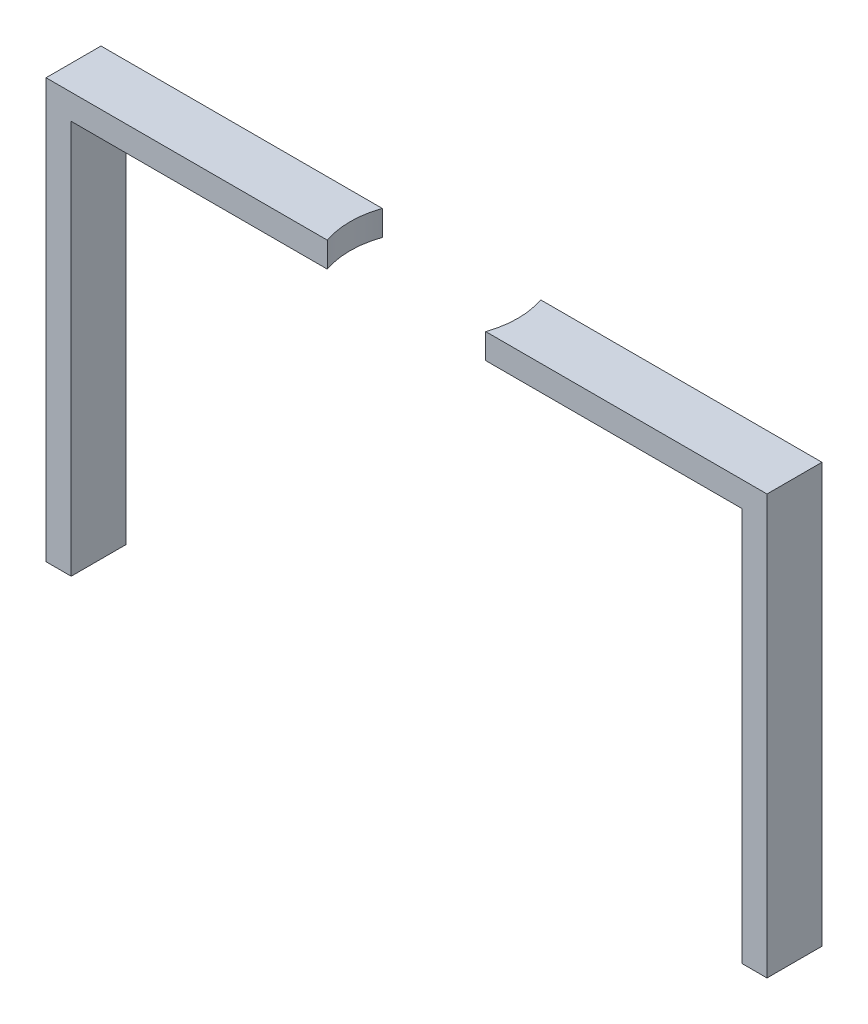
from build123d import *

# Parameters (mm, degrees)
EXTRUDE_1_DEPTH     = 32.78
SKETCH_2_R          = 50
CUT_EXTRUDE_1_DEPTH = 15


with BuildPart() as part:
    # 草图1 → 凸台-拉伸1 (new body)
    with BuildSketch(Plane.XY):
        Polygon((-369.854368932, -113.927184466), (-354.854368932, -113.927184466), (-354.854368932, 121.072815534), (45.145631068, 121.072815534), (45.145631068, -113.927184466), (60.145631068, -113.927184466), (60.145631068, 136.072815534), (-369.854368932, 136.072815534), align=None)
    extrude(amount=EXTRUDE_1_DEPTH)

    # 草图2 → 切除-拉伸1 (cut)
    with BuildSketch(Plane(origin=(0, 136.072815534, 0), x_dir=(1, 0, 0), z_dir=(0, 1, 0))):
        with Locations((-154.854368932, -16.39)):
            Circle(SKETCH_2_R)
    extrude(amount=-CUT_EXTRUDE_1_DEPTH, mode=Mode.SUBTRACT)


with BuildPart() as cut_extrude_1_piece_1:
    # of the separate pieces the step leaves, piece 1, a body of its own (cut_extrude_1_pieces)
    add(part.part.solids().sort_by_distance((-369.854368932, -113.927184466, 0))[0])


with BuildPart() as cut_extrude_1_piece_2:
    # of the separate pieces the step leaves, piece 2, a body of its own (cut_extrude_1_pieces)
    add(part.part.solids().sort_by_distance((60.145631068, 136.072815534, 0))[0])


solid = Compound([cut_extrude_1_piece_1.part, cut_extrude_1_piece_2.part])
